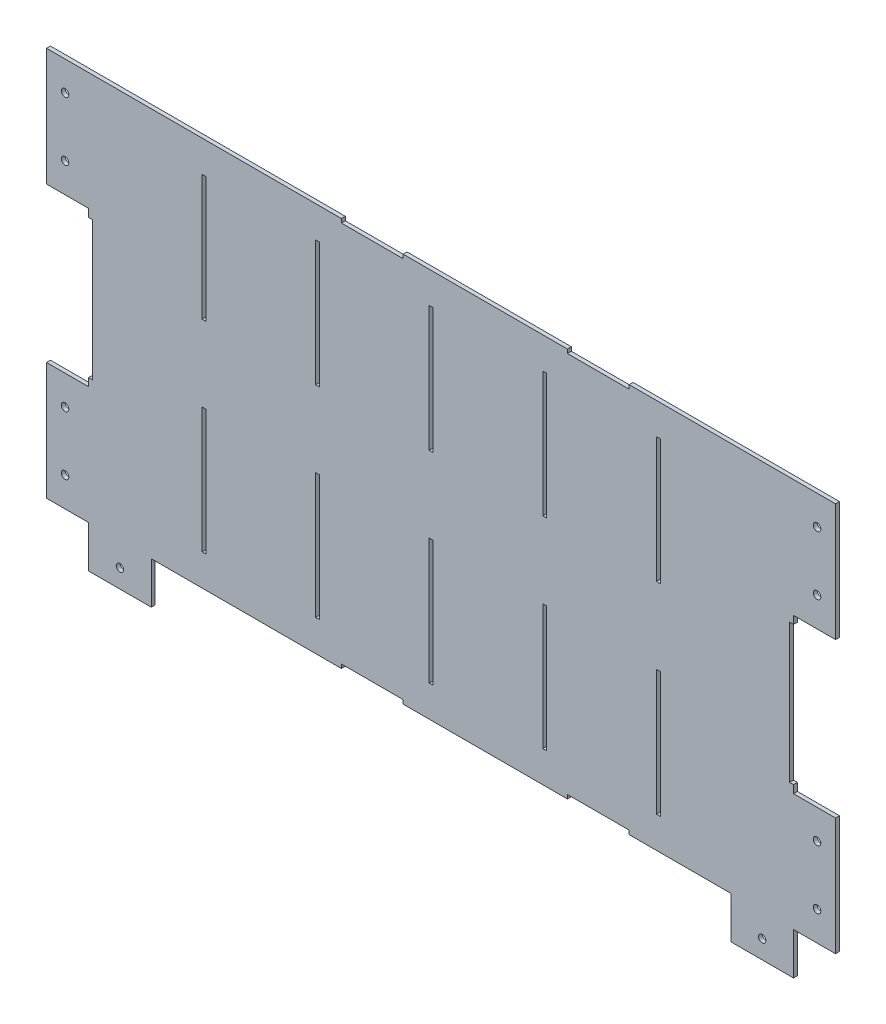
from build123d import *

# Parameters (mm, degrees)
SKETCH1_W                 = 570.860988324
SKETCH1_H                 = 315.575
BOSS_EXTRUDE1_DEPTH       = 3.175
SKETCH2_W                 = 3.175
SKETCH2_H                 = 101.6
CUT_EXTRUDE1_DEPTH        = 3.175
SKETCH7_W                 = 50
SKETCH7_H                 = 3.175
CUT_EXTRUDE5_DEPTH        = 3.175
LPATTERN2_COUNT           = 5
LPATTERN2_PITCH           = 91.96
LPATTERN2_COPY_1_SKETCH_W = 3.175
LPATTERN2_COPY_1_SKETCH_H = 101.6
LPATTERN2_COPY_1_DEPTH    = 3.175
LPATTERN2_COPY_2_SKETCH_W = 3.175
LPATTERN2_COPY_2_SKETCH_H = 101.6
LPATTERN2_COPY_2_DEPTH    = 3.175
LPATTERN2_COPY_3_SKETCH_W = 3.175
LPATTERN2_COPY_3_SKETCH_H = 101.6
LPATTERN2_COPY_3_DEPTH    = 3.175
LPATTERN2_COPY_4_SKETCH_W = 3.175
LPATTERN2_COPY_4_SKETCH_H = 101.6
LPATTERN2_COPY_4_DEPTH    = 3.175
SKETCH9_W                 = 34.036
SKETCH9_H                 = 95.25
SKETCH9_R                 = 3.048
SKETCH9_W_2               = 50.8
SKETCH9_H_2               = 33.988
SKETCH9_R_2               = 3
BOSS_EXTRUDE3_DEPTH       = 3.175
SKETCH10_W                = 3.175
SKETCH10_H                = 112.375
CUT_EXTRUDE6_DEPTH        = 373.621475384


with BuildPart() as part:
    # Sketch1 → Boss-Extrude1 (new body)
    with BuildSketch(Plane.XY):
        Rectangle(SKETCH1_W, SKETCH1_H)
    extrude(amount=BOSS_EXTRUDE1_DEPTH)

    # Sketch2 → Cut-Extrude1 (cut)
    with BuildSketch(Plane.XY.offset(3.175)):
        with Locations((-191.887994162, -81.5875)):
            Rectangle(SKETCH2_W, SKETCH2_H)
    cut_extrude1 = extrude(amount=-CUT_EXTRUDE1_DEPTH, mode=Mode.SUBTRACT)

    # Sketch7 → Cut-Extrude5 (cut)
    with BuildSketch(Plane.XY.offset(3.175)):
        with Locations((127.304934912, -156.2)):
            Rectangle(SKETCH7_W, SKETCH7_H)
        with Locations((-55.695065088, -156.2)):
            Rectangle(SKETCH7_W, SKETCH7_H)
    cut_extrude5 = extrude(amount=-CUT_EXTRUDE5_DEPTH, mode=Mode.SUBTRACT)

    # Mirror3: Cut-Extrude1 across plane
    add(cut_extrude1.mirror(Plane.ZX), mode=Mode.SUBTRACT)

    # LPattern2: Cut-Extrude1 ×5
    with Locations(*[(i * LPATTERN2_PITCH, 0, 0) for i in range(1, LPATTERN2_COUNT)]):
        add(cut_extrude1, mode=Mode.SUBTRACT)

    # LPattern2 copy 1 sketch → LPattern2 copy 1 (cut)
    with BuildSketch(Plane(origin=(91.96, 0, 3.175), x_dir=(1, 0, 0), z_dir=(0, 0, 1))):
        with Locations((-191.887994162, 81.5875)):
            Rectangle(LPATTERN2_COPY_1_SKETCH_W, LPATTERN2_COPY_1_SKETCH_H)
    extrude(amount=-LPATTERN2_COPY_1_DEPTH, mode=Mode.SUBTRACT)

    # LPattern2 copy 2 sketch → LPattern2 copy 2 (cut)
    with BuildSketch(Plane(origin=(183.92, 0, 3.175), x_dir=(1, 0, 0), z_dir=(0, 0, 1))):
        with Locations((-191.887994162, 81.5875)):
            Rectangle(LPATTERN2_COPY_2_SKETCH_W, LPATTERN2_COPY_2_SKETCH_H)
    extrude(amount=-LPATTERN2_COPY_2_DEPTH, mode=Mode.SUBTRACT)

    # LPattern2 copy 3 sketch → LPattern2 copy 3 (cut)
    with BuildSketch(Plane(origin=(275.88, 0, 3.175), x_dir=(1, 0, 0), z_dir=(0, 0, 1))):
        with Locations((-191.887994162, 81.5875)):
            Rectangle(LPATTERN2_COPY_3_SKETCH_W, LPATTERN2_COPY_3_SKETCH_H)
    extrude(amount=-LPATTERN2_COPY_3_DEPTH, mode=Mode.SUBTRACT)

    # LPattern2 copy 4 sketch → LPattern2 copy 4 (cut)
    with BuildSketch(Plane(origin=(367.84, 0, 3.175), x_dir=(1, 0, 0), z_dir=(0, 0, 1))):
        with Locations((-191.887994162, 81.5875)):
            Rectangle(LPATTERN2_COPY_4_SKETCH_W, LPATTERN2_COPY_4_SKETCH_H)
    extrude(amount=-LPATTERN2_COPY_4_DEPTH, mode=Mode.SUBTRACT)

    # Sketch9 → Boss-Extrude3 (add)
    # profile 1 of 3: a face of its own
    with BuildSketch(Plane(origin=(0, 0, 0), x_dir=(-1, 0, 0), z_dir=(0, 0, -1))):
        with Locations((-302.448494162, 110.1625)):
            Rectangle(SKETCH9_W, SKETCH9_H)
        with Locations((-304.480494162, 86.35)):
            Circle(SKETCH9_R, mode=Mode.SUBTRACT)
        with Locations((-304.480494162, 133.975)):
            Circle(SKETCH9_R, mode=Mode.SUBTRACT)
    # profile 2 of 3: a face of its own
    with BuildSketch(Plane(origin=(0, 0, 0), x_dir=(-1, 0, 0), z_dir=(0, 0, -1))):
        with Locations((-302.448494162, -110.1625)):
            Rectangle(SKETCH9_W, SKETCH9_H)
        with Locations((-304.480494162, -133.975)):
            Circle(SKETCH9_R, mode=Mode.SUBTRACT)
        with Locations((-304.480494162, -86.35)):
            Circle(SKETCH9_R, mode=Mode.SUBTRACT)
    # profile 3 of 3: a face of its own
    with BuildSketch(Plane(origin=(0, 0, 0), x_dir=(-1, 0, 0), z_dir=(0, 0, -1))):
        with Locations((-260.030494162, -174.7815)):
            Rectangle(SKETCH9_W_2, SKETCH9_H_2)
        with Locations((-260.030494162, -176.8375)):
            Circle(SKETCH9_R_2, mode=Mode.SUBTRACT)
    boss_extrude3 = extrude(amount=-BOSS_EXTRUDE3_DEPTH)

    # Mirror4: Boss-Extrude3 across plane
    add(boss_extrude3.mirror(Plane(origin=(0, 0, 0), x_dir=(0, 0, 1), z_dir=(1, 0, 0))))

    # Mirror5: Cut-Extrude5 across plane
    add(cut_extrude5.mirror(Plane.ZX), mode=Mode.SUBTRACT)

    # Sketch10 → Cut-Extrude6 (cut, through all)
    with BuildSketch(Plane(origin=(0, 0, 0), x_dir=(-1, 0, 0), z_dir=(0, 0, -1))):
        with Locations((-283.842994162, 0)):
            Rectangle(SKETCH10_W, SKETCH10_H)
    cut_extrude6 = extrude(amount=-CUT_EXTRUDE6_DEPTH, mode=Mode.SUBTRACT)

    # Mirror6: Cut-Extrude6 across plane
    add(cut_extrude6.mirror(Plane(origin=(0, 0, 0), x_dir=(0, 0, 1), z_dir=(1, 0, 0))), mode=Mode.SUBTRACT)


solid = part.part
